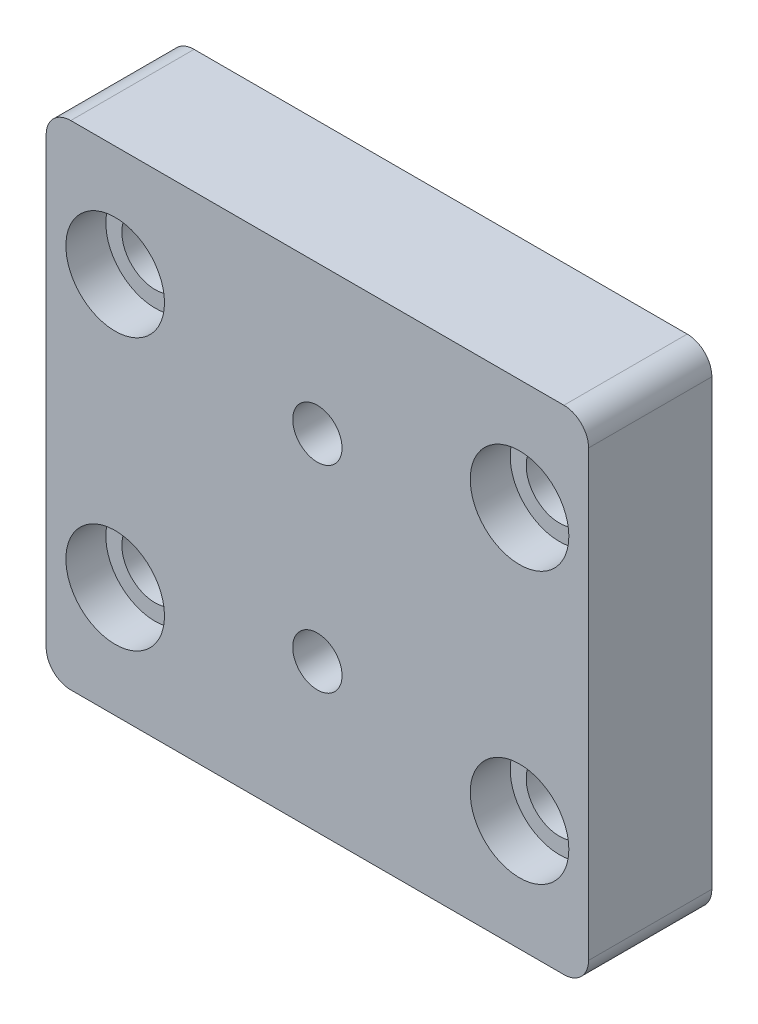
from build123d import *

# Parameters (mm, degrees)
SKIZZE1_W                                            = 110
SKIZZE1_H                                            = 100
AUFSATZ_LINEAR_AUSTRAGEN1_DEPTH                      = 25
VERRUNDUNG1_R                                        = 5
STIRNSENKUNG_F_R_M12_ZYLINDERSCHRAUBE_MI_D           = 13.5
STIRNSENKUNG_F_R_M12_ZYLINDERSCHRAUBE_MI_CBORE_D     = 20
STIRNSENKUNG_F_R_M12_ZYLINDERSCHRAUBE_MI_CBORE_DEPTH = 8.1
F_10_0MM_STIFTLOCH1_D                                = 10
F_10_0MM_STIFTLOCH1_DEPTH                            = 10
F_10_0MM_STIFTLOCH1_TIP                              = 3.004303095


with BuildPart() as part:
    # Skizze1 → Aufsatz-Linear austragen1 (new body)
    with BuildSketch(Plane.XY):
        Rectangle(SKIZZE1_W, SKIZZE1_H)
    extrude(amount=AUFSATZ_LINEAR_AUSTRAGEN1_DEPTH)

    # Verrundung1
    verrundung1_edges = [part.edges().sort_by_distance(p)[0] for p in [
        (55, -50, 12.5),
        (-55, -50, 12.5),
        (-55, 50, 12.5),
        (55, 50, 12.5),
    ]]
    fillet(verrundung1_edges, radius=VERRUNDUNG1_R)

    # Stirnsenkung für M12 Zylinderschraube mit Innensechskant1 (through all)
    with Locations(Plane.XY.offset(25)):
        with Locations((-41, 27.5), (41, 27.5), (41, -27.5), (-41, -27.5)):
            CounterBoreHole(STIRNSENKUNG_F_R_M12_ZYLINDERSCHRAUBE_MI_D / 2, STIRNSENKUNG_F_R_M12_ZYLINDERSCHRAUBE_MI_CBORE_D / 2, STIRNSENKUNG_F_R_M12_ZYLINDERSCHRAUBE_MI_CBORE_DEPTH)

    # Ø10.0mm Stiftloch1
    with Locations(Plane.XY.offset(25)):
        with Locations((0, 20), (0, -20)):
            Hole(F_10_0MM_STIFTLOCH1_D / 2, depth=F_10_0MM_STIFTLOCH1_DEPTH)
            with Locations((0, 0, -(F_10_0MM_STIFTLOCH1_DEPTH + F_10_0MM_STIFTLOCH1_TIP / 2))):  # 118° drill point
                Cone(0, F_10_0MM_STIFTLOCH1_D / 2, F_10_0MM_STIFTLOCH1_TIP, mode=Mode.SUBTRACT)


solid = part.part
